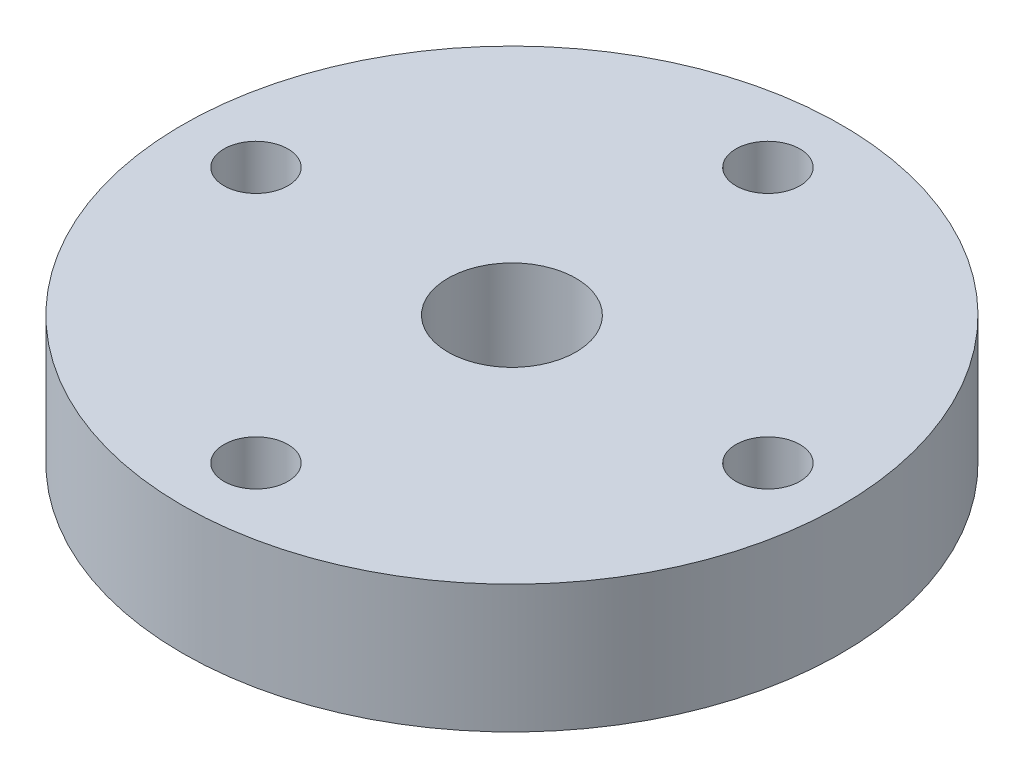
from build123d import *

# Parameters (mm, degrees)
SKETCH1_R           = 10.3
SKETCH1_R_2         = 2
BOSS_EXTRUDE1_DEPTH = 4
SKETCH2_R           = 1
CUT_EXTRUDE1_DEPTH  = 4
SKETCH3_R           = 6
SKETCH3_R_2         = 4.25
CUT_EXTRUDE2_DEPTH  = 2


with BuildPart() as part:
    # Sketch1 → Boss-Extrude1 (new body)
    with BuildSketch(Plane(origin=(0, 0, 0), x_dir=(1, 0, 0), z_dir=(0, 1, 0))):
        with Locations(Location((0, 0, 0), (0, 0, 270))):
            Circle(SKETCH1_R)
        with Locations(Location((0, 0, 0), (0, 0, 270))):
            Circle(SKETCH1_R_2, mode=Mode.SUBTRACT)
    extrude(amount=BOSS_EXTRUDE1_DEPTH)

    # Sketch2 → Cut-Extrude1 (cut)
    with BuildSketch(Plane(origin=(0, 4, 0), x_dir=(-1, 0, 0), z_dir=(0, 1, 0))):
        with Locations(Location((0, -8, 0), (0, 0, 90))):
            Circle(SKETCH2_R)
        with Locations(Location((8, 0, 0), (0, 0, 90))):
            Circle(SKETCH2_R)
        with Locations(Location((-8, 0, 0), (0, 0, 90))):
            Circle(SKETCH2_R)
        with Locations(Location((0, 8, 0), (0, 0, 90))):
            Circle(SKETCH2_R)
    extrude(amount=-CUT_EXTRUDE1_DEPTH, mode=Mode.SUBTRACT)

    # Sketch3 → Cut-Extrude2 (cut)
    with BuildSketch(Plane.XZ):
        with Locations(Location((0, 0, 0), (0, 0, 270))):
            Circle(SKETCH3_R)
        with Locations(Location((0, 0, 0), (0, 0, 270))):
            Circle(SKETCH3_R_2, mode=Mode.SUBTRACT)
    extrude(amount=-CUT_EXTRUDE2_DEPTH, mode=Mode.SUBTRACT)


solid = part.part
